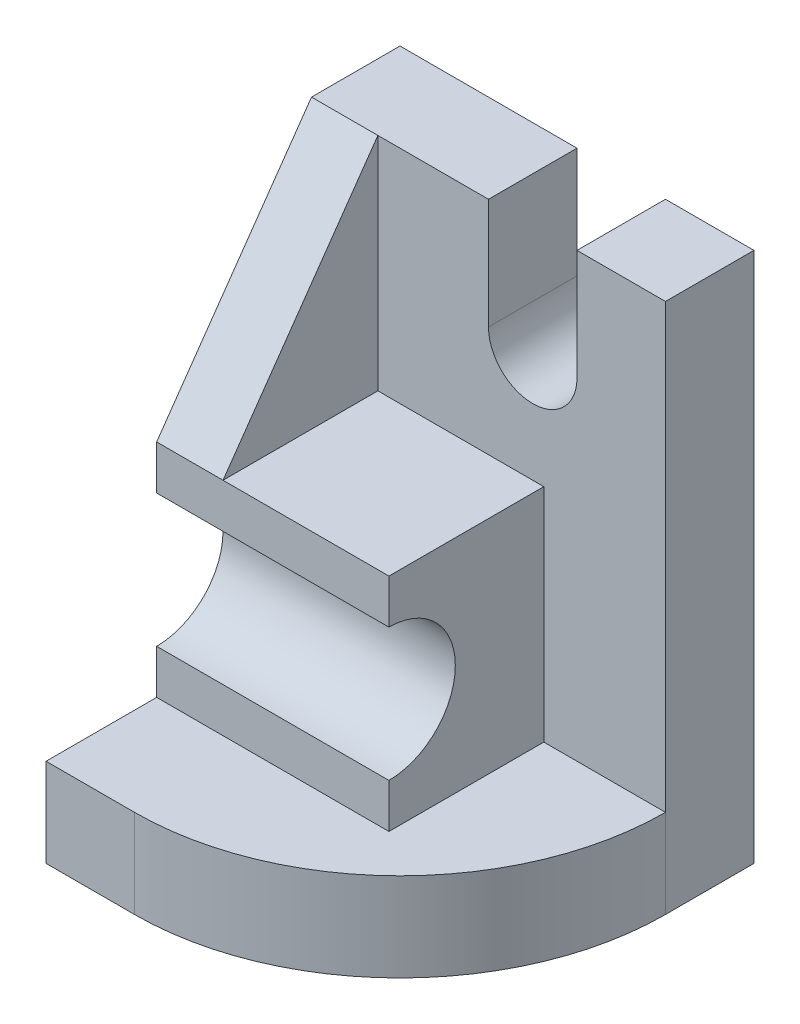
from build123d import *

# Parameters (mm, degrees)
ESQUISSE1_W             = 96
ESQUISSE1_H             = 64
BOSS_EXTRU_1_DEPTH      = 16
ENL_V_MAT_EXTRU_2_DEPTH = 117.481758228
BOSS_EXTRU_2_DEPTH      = 16
ESQUISSE5_W             = 42
ESQUISSE5_H             = 40
BOSS_EXTRU_3_DEPTH      = 28
ENL_V_MAT_EXTRU_4_REACH = 124.784
ESQUISSE7_R             = 12
BOSS_EXTRU_4_DEPTH      = 12


with BuildPart() as part:
    # Esquisse1 → Boss.-Extru.1 (new body)
    with BuildSketch(Plane(origin=(0, 0, 0), x_dir=(0, 1, 0), z_dir=(0, 0, 1))):
        with Locations((48, 32)):
            Rectangle(ESQUISSE1_W, ESQUISSE1_H)
    extrude(amount=BOSS_EXTRU_1_DEPTH)

    # Esquisse2 → Enlèv. mat.-Extru.2 (cut, through all)
    with BuildSketch(Plane.XY.offset(16)):
        with BuildLine():
            Line((-16, 96), (-16, 76))
            ThreePointArc((-16, 76), (-24, 68), (-32, 76))
            Line((-32, 76), (-32, 96))
            ThreePointArc((-32, 96), (-24, 104), (-16, 96))
        make_face()
    extrude(amount=-ENL_V_MAT_EXTRU_2_DEPTH, mode=Mode.SUBTRACT)

    # Esquisse4 → Boss.-Extru.2 (add)
    with BuildSketch(Plane.XZ):
        with BuildLine():
            Line((-64, 0), (0, 0))
            Line((0, 0), (0, 16))
            ThreePointArc((0, 16), (-14.058874503, 49.941125497), (-48, 64))
            Line((-48, 64), (-64, 64))
            Line((-64, 64), (-64, 0))
        make_face()
    extrude(amount=-BOSS_EXTRU_2_DEPTH)

    # Esquisse5 → Boss.-Extru.3 (add)
    with BuildSketch(Plane.XY.offset(16)):
        with Locations((-43, 36)):
            Rectangle(ESQUISSE5_W, ESQUISSE5_H)
    extrude(amount=BOSS_EXTRU_3_DEPTH)

    # Esquisse7 → Enlèv. mat.-Extru.4 (cut, up to next)
    with BuildSketch(Plane.YZ.offset(-22), mode=Mode.PRIVATE) as enl_v_mat_extru_4_sk1:
        with Locations((36, 44)):
            Circle(ESQUISSE7_R)
    enl_v_mat_extru_4_tool1 = extrude(enl_v_mat_extru_4_sk1.sketch, amount=-ENL_V_MAT_EXTRU_4_REACH, mode=Mode.PRIVATE) & part.part
    add(enl_v_mat_extru_4_tool1.solids().sort_by_distance((-22, 36, 44))[0], mode=Mode.SUBTRACT)

    # Esquisse8 → Boss.-Extru.4 (add)
    with BuildSketch(Plane(origin=(-64, 0, 0), x_dir=(0, -1, 0), z_dir=(-1, 0, 0))):
        Polygon((-56, 44), (-96, 16), (-56, 16), align=None)
    extrude(amount=-BOSS_EXTRU_4_DEPTH)


solid = part.part
